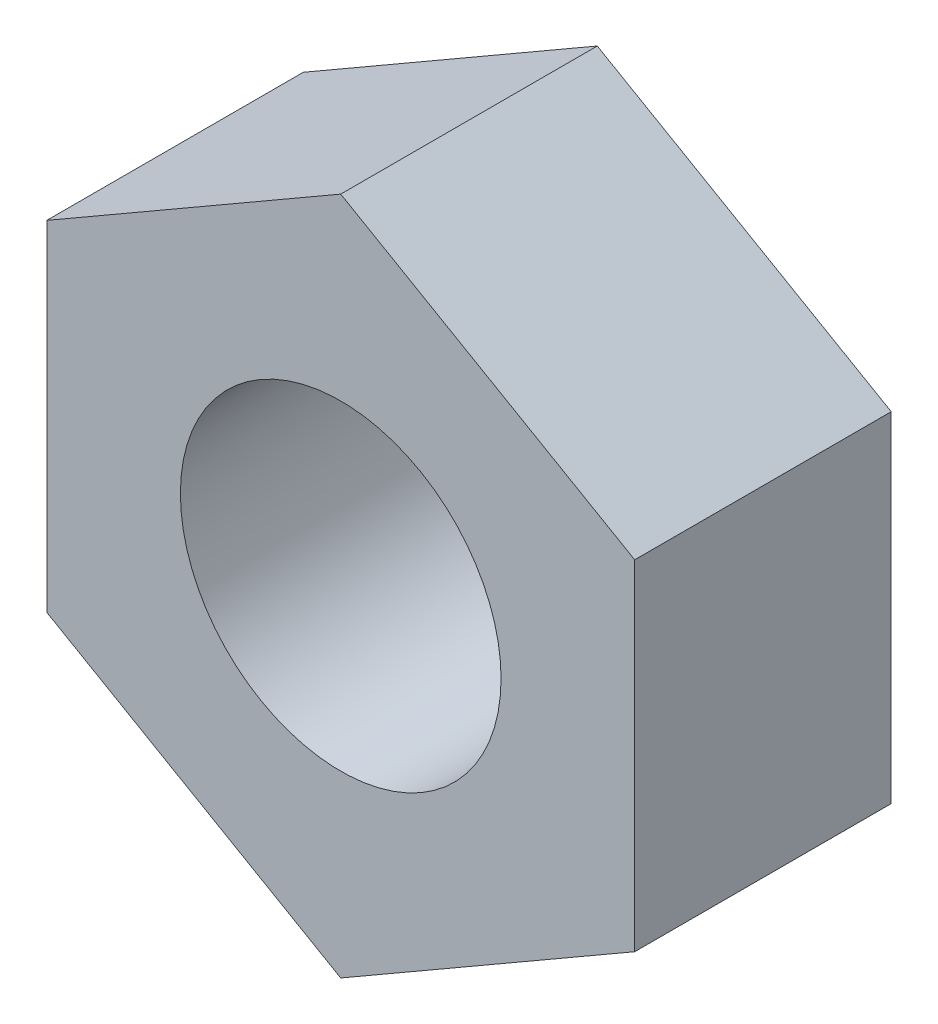
from build123d import *

# Parameters (mm, degrees)
NUT_START = -1.2
SKETCH1_R = 1.5
NUT_DEPTH = 2.4


with BuildPart() as part:
    # Sketch1 → Nut (new body)
    with BuildSketch(Plane.XY.offset(NUT_START)):
        Polygon((2.75, 1.58771324), (0, 3.175426481), (-2.75, 1.58771324), (-2.75, -1.58771324), (0, -3.175426481), (2.75, -1.58771324), align=None)
        Circle(SKETCH1_R, mode=Mode.SUBTRACT)
    extrude(amount=NUT_DEPTH)


solid = part.part
